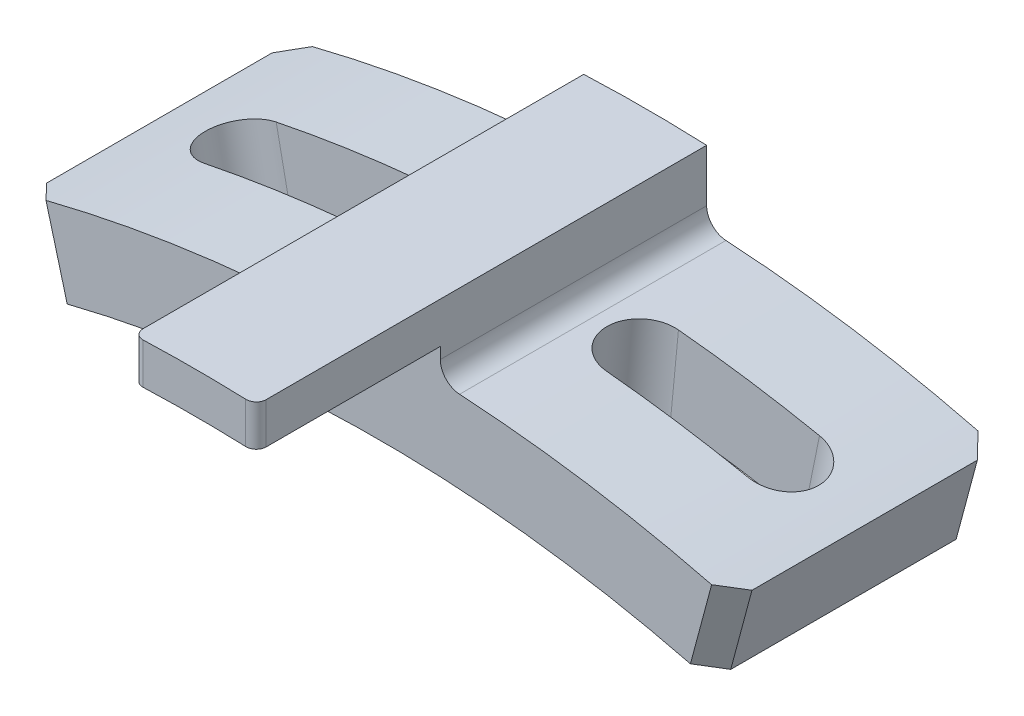
from build123d import *

# Parameters (mm, degrees)
EXTRUDE_1_DEPTH          = 6.5
EXTRUDE_START            = 9
EXTRUDE_2_DEPTH          = 9
PATTERN_CIRCULAR_1_COUNT = 2
PATTERN_CIRCULAR_1_ANGLE = 6
CUT_EXTRUDE_2_DEPTH      = 1.75
FILLET_1_R               = 1
CHAMFER_1_SIZE           = 1
FILLET_2_R               = 0.5


with BuildPart() as part:
    # Эскиз1 → Бобышка-Вытянуть1 (new, symmetric)
    with BuildSketch(Plane.XY):
        with BuildLine():
            Line((16.176190319, 60.370364143), (17.211466499, 64.234067448))
            ThreePointArc((17.211466499, 64.234067448), (10.165328185, 65.718460899), (3, 66.432296363))
            Line((3, 66.432296363), (3, 69.93568474))
            ThreePointArc((3, 69.93568474), (0, 70), (-3, 69.93568474))
            Line((-3, 69.93568474), (-3, 66.432296363))
            ThreePointArc((-3, 66.432296363), (-10.165328185, 65.718460899), (-17.211466499, 64.234067448))
            Line((-17.211466499, 64.234067448), (-16.176190319, 60.370364143))
            ThreePointArc((-16.176190319, 60.370364143), (0, 62.5), (16.176190319, 60.370364143))
        make_face()
    extrude(amount=EXTRUDE_1_DEPTH, both=True)

    # Эскиз2 → Бобышка-Вытянуть2 (add)
    with BuildSketch(Plane.XY.offset(6.5).offset(EXTRUDE_START)):
        with BuildLine():
            Line((3, 67.933791297), (3, 69.93568474))
            ThreePointArc((3, 69.93568474), (0, 70), (-3, 69.93568474))
            Line((-3, 69.93568474), (-3, 67.933791297))
            ThreePointArc((-3, 67.933791297), (0, 68), (3, 67.933791297))
        make_face()
    extrude(amount=-EXTRUDE_2_DEPTH)

    # Эскиз4 → Вырез-Повернуть1 (revolve, cut)
    with BuildSketch(Plane.XY):
        Polygon((15.172618915, 65.798064004), (13.738323432, 58.748276473), (12.023455199, 59.097170358), (13.457750682, 66.146957889), align=None)
    cut_revolve_1 = revolve(axis=Axis((0, 0, 0), (0.19936793441719766, 0.9799247046208296, 0)), mode=Mode.SUBTRACT)

    # Круговой массив1: Вырез-Повернуть1 ×2 about axis
    pattern_circular_1_axis = Axis((0, 0, 6.5), (0, 0, 1))
    for i in range(1, PATTERN_CIRCULAR_1_COUNT):
        add(cut_revolve_1.rotate(pattern_circular_1_axis, i * PATTERN_CIRCULAR_1_ANGLE / (PATTERN_CIRCULAR_1_COUNT - 1)), mode=Mode.SUBTRACT)

    # Эскиз6 → Вырез-Вытянуть2 (cut, symmetric)
    with BuildSketch(Plane.XY):
        with BuildLine():
            Line((5.990359533, 62.212262398), (6.373742543, 66.193847191))
            ThreePointArc((6.373742543, 66.193847191), (9.82932584, 65.769554914), (13.257967639, 65.164992857))
            Line((13.257967639, 65.164992857), (12.460495901, 61.245294039))
            ThreePointArc((12.460495901, 61.245294039), (9.238088196, 61.81349146), (5.990359533, 62.212262398))
        make_face()
    cut_extrude_2 = extrude(amount=CUT_EXTRUDE_2_DEPTH, both=True, mode=Mode.SUBTRACT)

    # Зеркальное отражение1: Вырез-Повернуть1, Вырез-Вытянуть2 across plane
    add(cut_revolve_1.mirror(Plane(origin=(0, 0, 0), x_dir=(0, 0, 1), z_dir=(1, 0, 0))), mode=Mode.SUBTRACT)
    add(cut_extrude_2.mirror(Plane(origin=(0, 0, 0), x_dir=(0, 0, 1), z_dir=(1, 0, 0))), mode=Mode.SUBTRACT)

    # Зеркальное отражение1 copy 1 sketch → Зеркальное отражение1 copy 1 (revolve, cut)
    with BuildSketch(Plane(origin=(0, 0, 0), x_dir=(-0.9945218953682733, 0.10452846326765369, 0), z_dir=(0, 0, 1))):
        Polygon((15.172618915, -65.798064004), (13.738323432, -58.748276473), (12.023455199, -59.097170358), (13.457750682, -66.146957889), align=None)
    revolve(axis=Axis((0, 0, 0), (0.09584575252022424, -0.9953961983671789, 0)), mode=Mode.SUBTRACT)

    # Скругление1
    fillet_1_edges = [part.edges().sort_by_distance(p)[0] for p in [
        (-3, 66.432296363, 0),
        (3, 66.432296363, 0),
    ]]
    fillet(fillet_1_edges, radius=FILLET_1_R)

    # Фаска1
    chamfer_1_edges = [part.edges().sort_by_distance(p)[0] for p in [
        (16.693828409, 62.302215796, -6.5),
        (-16.693828409, 62.302215796, 6.5),
        (-16.693828409, 62.302215796, -6.5),
        (16.693828409, 62.302215796, 6.5),
    ]]
    chamfer(chamfer_1_edges, length=CHAMFER_1_SIZE)

    # Скругление2
    fillet_2_edges = [part.edges().sort_by_distance(p)[0] for p in [
        (-3, 68.934738018, 15.5),
        (3, 68.934738018, 15.5),
    ]]
    fillet(fillet_2_edges, radius=FILLET_2_R)


solid = part.part
